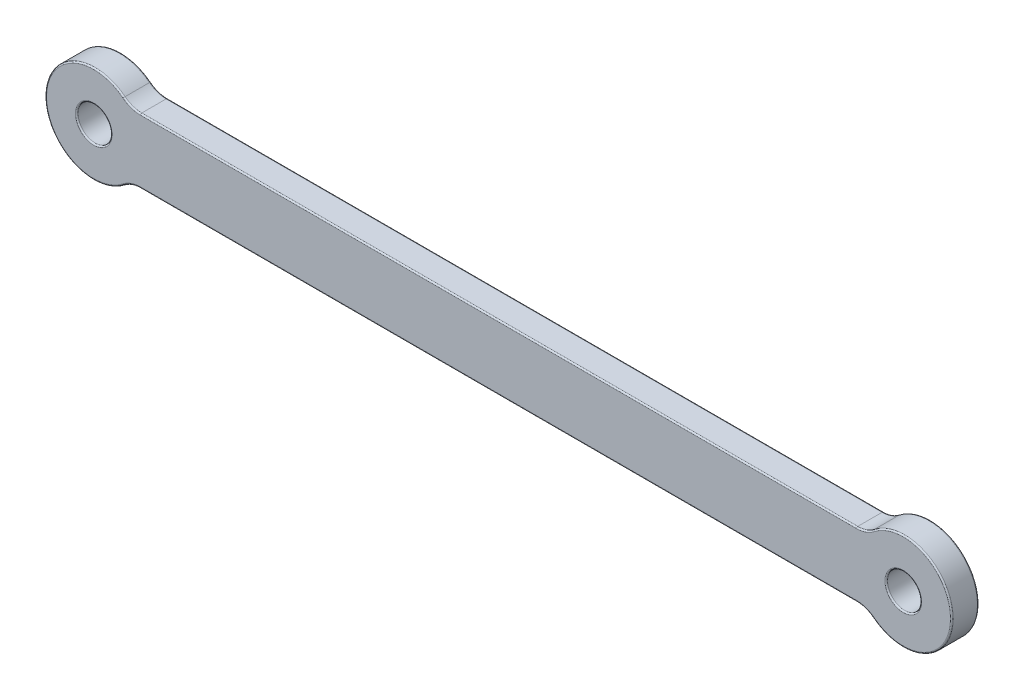
from build123d import *

# Parameters (mm, degrees)
SKETCH1_R           = 3.15
BOSS_EXTRUDE2_DEPTH = 5
FILLET1_R           = 5
FILLET2_R           = 0.25


with BuildPart() as part:
    # Sketch1 → Boss-Extrude2 (new body)
    with BuildSketch(Plane.XY):
        with BuildLine():
            Line((143.291796068, 6), (6.708203932, 6))
            ThreePointArc((6.708203932, 6), (-9, 0), (6.708203932, -6))
            Line((6.708203932, -6), (75, -6))
            Line((75, -6), (143.291796068, -6))
            ThreePointArc((143.291796068, -6), (159, 0), (143.291796068, 6))
        make_face()
        Circle(SKETCH1_R, mode=Mode.SUBTRACT)
        with Locations((150, 0)):
            Circle(SKETCH1_R, mode=Mode.SUBTRACT)
    extrude(amount=BOSS_EXTRUDE2_DEPTH)

    # Fillet1
    fillet1_edges = [part.edges().sort_by_distance(p)[0] for p in [
        (143.291796068, -6, 2.5),
        (6.708203932, -6, 2.5),
        (6.708203932, 6, 2.5),
        (143.291796068, 6, 2.5),
    ]]
    fillet(fillet1_edges, radius=FILLET1_R)

    # Fillet2
    fillet2_edges = [part.edges().sort_by_distance(p)[0] for p in [
        (75, -6, 0),
        (75, -6, 5),
        (-9, 0, 0),
        (-9, 0, 5),
        (159, 0, 0),
        (146.85, 0, 5),
        (159, 0, 5),
        (75, 6, 0),
        (75, 6, 5),
        (7.023619861, -6.275444087, 0),
        (7.023619861, -6.275444087, 5),
        (-3.15, 0, 5),
        (142.976380139, -6.275444087, 0),
        (142.976380139, -6.275444087, 5),
        (142.976380139, 6.275444087, 0),
        (142.976380139, 6.275444087, 5),
        (7.023619861, 6.275444087, 0),
        (7.023619861, 6.275444087, 5),
        (-3.15, 0, 0),
        (146.85, 0, 0),
    ]]
    fillet(fillet2_edges, radius=FILLET2_R)


solid = part.part
